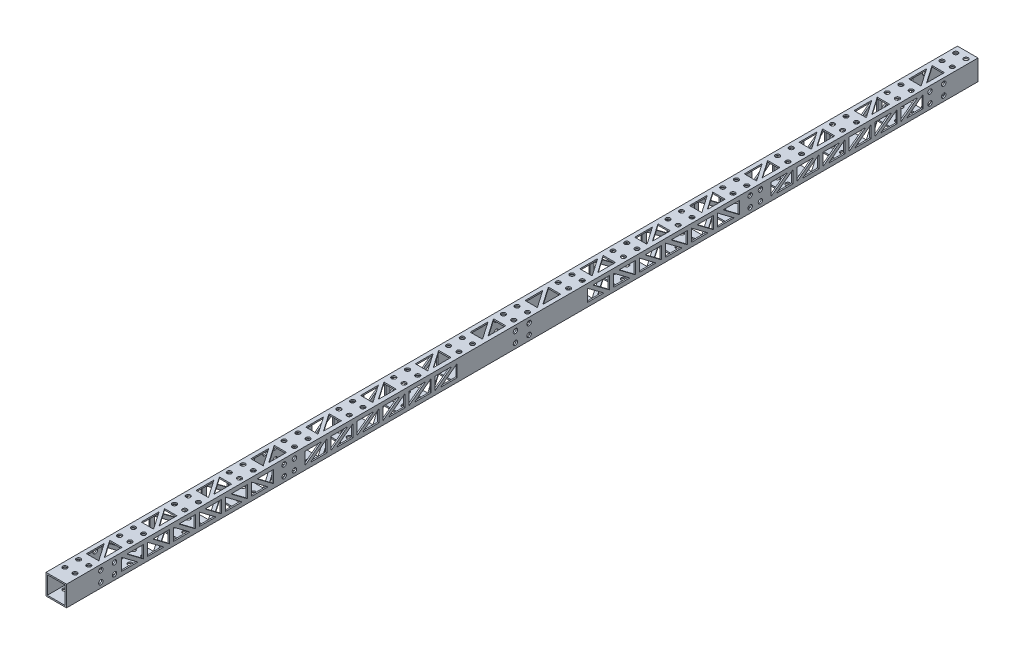
from build123d import *

# Parameters (mm, degrees)
SKETCH_1_W          = 15
SKETCH_1_H          = 15
SKETCH_1_W_2        = 13
SKETCH_1_H_2        = 13
EXTRUDE_1_DEPTH     = 665
SKETCH_2_R          = 1.6
CUT_EXTRUDE_1_DEPTH = 666.338259835
SKETCH_3_R          = 1.6
CUT_EXTRUDE_2_DEPTH = 666.338259835


with BuildPart() as part:
    # 草图1 → 拉伸-薄壁1 (new body)
    with BuildSketch(Plane.XY):
        with Locations((7.5, -7.5)):
            Rectangle(SKETCH_1_W, SKETCH_1_H)
        with Locations((7.5, -7.5)):
            Rectangle(SKETCH_1_W_2, SKETCH_1_H_2, mode=Mode.SUBTRACT)
    extrude(amount=EXTRUDE_1_DEPTH)

    # 草图2 → 切除-拉伸1 (cut, through all)
    with BuildSketch(Plane(origin=(15, 0, 0), x_dir=(0, 0, -1), z_dir=(1, 0, 0))):
        with Locations((-640, -3.75)):
            Circle(SKETCH_2_R)
        with Locations((-640, -11.25)):
            Circle(SKETCH_2_R)
        with Locations((-630, -11.25)):
            Circle(SKETCH_2_R)
        with Locations((-630, -3.75)):
            Circle(SKETCH_2_R)
        with Locations((-25, -3.75)):
            Circle(SKETCH_2_R)
        with Locations((-25, -11.25)):
            Circle(SKETCH_2_R)
        with Locations((-35, -11.25)):
            Circle(SKETCH_2_R)
        with Locations((-35, -3.75)):
            Circle(SKETCH_2_R)
        with Locations((-337.5, -3.75)):
            Circle(SKETCH_2_R)
        with Locations((-337.5, -11.25)):
            Circle(SKETCH_2_R)
        with Locations((-327.5, -11.25)):
            Circle(SKETCH_2_R)
        with Locations((-327.5, -3.75)):
            Circle(SKETCH_2_R)
        with Locations((-506.25, -3.75)):
            Circle(SKETCH_2_R)
        with Locations((-506.25, -11.25)):
            Circle(SKETCH_2_R)
        with Locations((-498.75, -11.25)):
            Circle(SKETCH_2_R)
        with Locations((-498.75, -3.75)):
            Circle(SKETCH_2_R)
        with Locations((-166.25, -3.75)):
            Circle(SKETCH_2_R)
        with Locations((-166.25, -11.25)):
            Circle(SKETCH_2_R)
        with Locations((-158.75, -11.25)):
            Circle(SKETCH_2_R)
        with Locations((-158.75, -3.75)):
            Circle(SKETCH_2_R)
        Polygon((-625, -3), (-625, -12), (-613, -12), align=None)
        Polygon((-621, -3), (-609, -3), (-609, -12), align=None)
        Polygon((-606, -3), (-606, -12), (-594, -12), align=None)
        Polygon((-590, -12), (-602, -3), (-590, -3), align=None)
        Polygon((-587, -3), (-587, -12), (-575, -12), align=None)
        Polygon((-571, -12), (-583, -3), (-571, -3), align=None)
        Polygon((-568, -3), (-568, -12), (-556, -12), align=None)
        Polygon((-552, -12), (-564, -3), (-552, -3), align=None)
        Polygon((-549, -3), (-549, -12), (-537, -12), align=None)
        Polygon((-533, -12), (-545, -3), (-533, -3), align=None)
        Polygon((-530, -3), (-530, -12), (-518, -12), align=None)
        Polygon((-514, -12), (-526, -3), (-514, -3), align=None)
        Polygon((-491, -3), (-491, -12), (-479, -3), align=None)
        Polygon((-475, -12), (-487, -12), (-475, -3), align=None)
        Polygon((-472, -3), (-472, -12), (-460, -3), align=None)
        Polygon((-456, -12), (-468, -12), (-456, -3), align=None)
        Polygon((-453, -3), (-453, -12), (-441, -3), align=None)
        Polygon((-437, -12), (-449, -12), (-437, -3), align=None)
        Polygon((-434, -3), (-434, -12), (-422, -3), align=None)
        Polygon((-418, -12), (-430, -12), (-418, -3), align=None)
        Polygon((-415, -3), (-415, -12), (-403, -3), align=None)
        Polygon((-399, -12), (-411, -12), (-399, -3), align=None)
        Polygon((-396, -12), (-384, -3), (-396, -3), align=None)
        Polygon((-392, -12), (-380, -3), (-380, -12), align=None)
        Polygon((-285, -3), (-285, -12), (-273, -12), align=None)
        Polygon((-281, -3), (-269, -3), (-269, -12), align=None)
        Polygon((-266, -3), (-266, -12), (-254, -12), align=None)
        Polygon((-250, -12), (-262, -3), (-250, -3), align=None)
        Polygon((-247, -3), (-247, -12), (-235, -12), align=None)
        Polygon((-231, -12), (-243, -3), (-231, -3), align=None)
        Polygon((-228, -3), (-228, -12), (-216, -12), align=None)
        Polygon((-212, -12), (-224, -3), (-212, -3), align=None)
        Polygon((-209, -3), (-209, -12), (-197, -12), align=None)
        Polygon((-193, -12), (-205, -3), (-193, -3), align=None)
        Polygon((-190, -3), (-190, -12), (-178, -12), align=None)
        Polygon((-174, -12), (-186, -3), (-174, -3), align=None)
        Polygon((-151, -3), (-151, -12), (-139, -3), align=None)
        Polygon((-135, -12), (-147, -12), (-135, -3), align=None)
        Polygon((-132, -3), (-132, -12), (-120, -3), align=None)
        Polygon((-116, -12), (-128, -12), (-116, -3), align=None)
        Polygon((-113, -3), (-113, -12), (-101, -3), align=None)
        Polygon((-97, -12), (-109, -12), (-97, -3), align=None)
        Polygon((-94, -3), (-94, -12), (-82, -3), align=None)
        Polygon((-78, -12), (-90, -12), (-78, -3), align=None)
        Polygon((-75, -3), (-75, -12), (-63, -3), align=None)
        Polygon((-59, -12), (-71, -12), (-59, -3), align=None)
        Polygon((-56, -12), (-44, -3), (-56, -3), align=None)
        Polygon((-52, -12), (-40, -3), (-40, -12), align=None)
    extrude(amount=-CUT_EXTRUDE_1_DEPTH, mode=Mode.SUBTRACT)

    # 草图3 → 切除-拉伸2 (cut, through all)
    with BuildSketch(Plane(origin=(0, 0, 0), x_dir=(1, 0, 0), z_dir=(0, 1, 0))):
        with Locations(Location((3.75, -5, 0), (0, 0, 270))):
            Circle(SKETCH_3_R)
        with Locations(Location((11.25, -5, 0), (0, 0, 90))):
            Circle(SKETCH_3_R)
        with Locations(Location((11.25, -15, 0), (0, 0, 270))):
            Circle(SKETCH_3_R)
        with Locations(Location((3.75, -15, 0), (0, 0, 90))):
            Circle(SKETCH_3_R)
        with Locations(Location((3.75, -45, 0), (0, 0, 270))):
            Circle(SKETCH_3_R)
        with Locations(Location((11.25, -45, 0), (0, 0, 90))):
            Circle(SKETCH_3_R)
        with Locations(Location((11.25, -55, 0), (0, 0, 270))):
            Circle(SKETCH_3_R)
        with Locations(Location((3.75, -55, 0), (0, 0, 90))):
            Circle(SKETCH_3_R)
        with Locations(Location((3.75, -85, 0), (0, 0, 270))):
            Circle(SKETCH_3_R)
        with Locations(Location((11.25, -85, 0), (0, 0, 90))):
            Circle(SKETCH_3_R)
        with Locations(Location((11.25, -95, 0), (0, 0, 270))):
            Circle(SKETCH_3_R)
        with Locations(Location((3.75, -95, 0), (0, 0, 90))):
            Circle(SKETCH_3_R)
        with Locations(Location((3.75, -125, 0), (0, 0, 270))):
            Circle(SKETCH_3_R)
        with Locations(Location((11.25, -125, 0), (0, 0, 90))):
            Circle(SKETCH_3_R)
        with Locations(Location((11.25, -135, 0), (0, 0, 270))):
            Circle(SKETCH_3_R)
        with Locations(Location((3.75, -135, 0), (0, 0, 90))):
            Circle(SKETCH_3_R)
        with Locations(Location((3.75, -165, 0), (0, 0, 270))):
            Circle(SKETCH_3_R)
        with Locations(Location((11.25, -165, 0), (0, 0, 90))):
            Circle(SKETCH_3_R)
        with Locations(Location((11.25, -175, 0), (0, 0, 270))):
            Circle(SKETCH_3_R)
        with Locations(Location((3.75, -175, 0), (0, 0, 90))):
            Circle(SKETCH_3_R)
        with Locations(Location((3.75, -205, 0), (0, 0, 270))):
            Circle(SKETCH_3_R)
        with Locations(Location((11.25, -205, 0), (0, 0, 90))):
            Circle(SKETCH_3_R)
        with Locations(Location((11.25, -215, 0), (0, 0, 270))):
            Circle(SKETCH_3_R)
        with Locations(Location((3.75, -215, 0), (0, 0, 90))):
            Circle(SKETCH_3_R)
        with Locations(Location((3.75, -245, 0), (0, 0, 270))):
            Circle(SKETCH_3_R)
        with Locations(Location((11.25, -245, 0), (0, 0, 90))):
            Circle(SKETCH_3_R)
        with Locations(Location((11.25, -255, 0), (0, 0, 270))):
            Circle(SKETCH_3_R)
        with Locations(Location((3.75, -255, 0), (0, 0, 90))):
            Circle(SKETCH_3_R)
        with Locations(Location((3.75, -285, 0), (0, 0, 270))):
            Circle(SKETCH_3_R)
        with Locations(Location((11.25, -285, 0), (0, 0, 90))):
            Circle(SKETCH_3_R)
        with Locations(Location((11.25, -295, 0), (0, 0, 270))):
            Circle(SKETCH_3_R)
        with Locations(Location((3.75, -295, 0), (0, 0, 90))):
            Circle(SKETCH_3_R)
        with Locations(Location((3.75, -325, 0), (0, 0, 270))):
            Circle(SKETCH_3_R)
        with Locations(Location((11.25, -325, 0), (0, 0, 90))):
            Circle(SKETCH_3_R)
        with Locations(Location((11.25, -335, 0), (0, 0, 270))):
            Circle(SKETCH_3_R)
        with Locations(Location((3.75, -335, 0), (0, 0, 90))):
            Circle(SKETCH_3_R)
        with Locations(Location((3.75, -365, 0), (0, 0, 270))):
            Circle(SKETCH_3_R)
        with Locations(Location((11.25, -365, 0), (0, 0, 90))):
            Circle(SKETCH_3_R)
        with Locations(Location((11.25, -375, 0), (0, 0, 270))):
            Circle(SKETCH_3_R)
        with Locations(Location((3.75, -375, 0), (0, 0, 90))):
            Circle(SKETCH_3_R)
        with Locations(Location((3.75, -405, 0), (0, 0, 270))):
            Circle(SKETCH_3_R)
        with Locations(Location((11.25, -405, 0), (0, 0, 90))):
            Circle(SKETCH_3_R)
        with Locations(Location((11.25, -415, 0), (0, 0, 270))):
            Circle(SKETCH_3_R)
        with Locations(Location((3.75, -415, 0), (0, 0, 90))):
            Circle(SKETCH_3_R)
        with Locations(Location((3.75, -445, 0), (0, 0, 270))):
            Circle(SKETCH_3_R)
        with Locations(Location((11.25, -445, 0), (0, 0, 90))):
            Circle(SKETCH_3_R)
        with Locations(Location((11.25, -455, 0), (0, 0, 270))):
            Circle(SKETCH_3_R)
        with Locations(Location((3.75, -455, 0), (0, 0, 90))):
            Circle(SKETCH_3_R)
        with Locations(Location((3.75, -485, 0), (0, 0, 270))):
            Circle(SKETCH_3_R)
        with Locations(Location((11.25, -485, 0), (0, 0, 90))):
            Circle(SKETCH_3_R)
        with Locations(Location((11.25, -495, 0), (0, 0, 270))):
            Circle(SKETCH_3_R)
        with Locations(Location((3.75, -495, 0), (0, 0, 90))):
            Circle(SKETCH_3_R)
        with Locations(Location((3.75, -525, 0), (0, 0, 270))):
            Circle(SKETCH_3_R)
        with Locations(Location((11.25, -525, 0), (0, 0, 90))):
            Circle(SKETCH_3_R)
        with Locations(Location((11.25, -535, 0), (0, 0, 270))):
            Circle(SKETCH_3_R)
        with Locations(Location((3.75, -535, 0), (0, 0, 90))):
            Circle(SKETCH_3_R)
        with Locations(Location((3.75, -565, 0), (0, 0, 270))):
            Circle(SKETCH_3_R)
        with Locations(Location((11.25, -565, 0), (0, 0, 90))):
            Circle(SKETCH_3_R)
        with Locations(Location((11.25, -575, 0), (0, 0, 270))):
            Circle(SKETCH_3_R)
        with Locations(Location((3.75, -575, 0), (0, 0, 90))):
            Circle(SKETCH_3_R)
        with Locations(Location((3.75, -605, 0), (0, 0, 270))):
            Circle(SKETCH_3_R)
        with Locations(Location((11.25, -605, 0), (0, 0, 90))):
            Circle(SKETCH_3_R)
        with Locations(Location((11.25, -615, 0), (0, 0, 270))):
            Circle(SKETCH_3_R)
        with Locations(Location((3.75, -615, 0), (0, 0, 90))):
            Circle(SKETCH_3_R)
        with Locations(Location((3.75, -645, 0), (0, 0, 270))):
            Circle(SKETCH_3_R)
        with Locations(Location((11.25, -645, 0), (0, 0, 90))):
            Circle(SKETCH_3_R)
        with Locations(Location((11.25, -655, 0), (0, 0, 270))):
            Circle(SKETCH_3_R)
        with Locations(Location((3.75, -655, 0), (0, 0, 90))):
            Circle(SKETCH_3_R)
        Polygon((3, -21.5), (12, -21.5), (12, -34.5), align=None)
        Polygon((3, -25.5), (3, -38.5), (12, -38.5), align=None)
        Polygon((3, -61.5), (12, -61.5), (12, -74.5), align=None)
        Polygon((12, -78.5), (3, -65.5), (3, -78.5), align=None)
        Polygon((3, -101.5), (12, -101.5), (12, -114.5), align=None)
        Polygon((12, -118.5), (3, -105.5), (3, -118.5), align=None)
        Polygon((3, -141.5), (12, -141.5), (12, -154.5), align=None)
        Polygon((12, -158.5), (3, -145.5), (3, -158.5), align=None)
        Polygon((3, -181.5), (12, -181.5), (12, -194.5), align=None)
        Polygon((12, -198.5), (3, -185.5), (3, -198.5), align=None)
        Polygon((3, -221.5), (12, -221.5), (12, -234.5), align=None)
        Polygon((12, -238.5), (3, -225.5), (3, -238.5), align=None)
        Polygon((3, -261.5), (12, -261.5), (12, -274.5), align=None)
        Polygon((12, -278.5), (3, -265.5), (3, -278.5), align=None)
        Polygon((3, -301.5), (12, -301.5), (12, -314.5), align=None)
        Polygon((12, -318.5), (3, -305.5), (3, -318.5), align=None)
        Polygon((3, -341.5), (12, -341.5), (12, -354.5), align=None)
        Polygon((12, -358.5), (3, -345.5), (3, -358.5), align=None)
        Polygon((3, -381.5), (12, -381.5), (12, -394.5), align=None)
        Polygon((12, -398.5), (3, -385.5), (3, -398.5), align=None)
        Polygon((3, -421.5), (12, -421.5), (12, -434.5), align=None)
        Polygon((12, -438.5), (3, -425.5), (3, -438.5), align=None)
        Polygon((3, -461.5), (12, -461.5), (12, -474.5), align=None)
        Polygon((12, -478.5), (3, -465.5), (3, -478.5), align=None)
        Polygon((3, -501.5), (12, -501.5), (12, -514.5), align=None)
        Polygon((12, -518.5), (3, -505.5), (3, -518.5), align=None)
        Polygon((3, -541.5), (12, -541.5), (12, -554.5), align=None)
        Polygon((12, -558.5), (3, -545.5), (3, -558.5), align=None)
        Polygon((3, -581.5), (12, -581.5), (12, -594.5), align=None)
        Polygon((12, -598.5), (3, -585.5), (3, -598.5), align=None)
        Polygon((3, -621.5), (12, -621.5), (12, -634.5), align=None)
        Polygon((12, -638.5), (3, -625.5), (3, -638.5), align=None)
    extrude(amount=-CUT_EXTRUDE_2_DEPTH, mode=Mode.SUBTRACT)


solid = part.part
